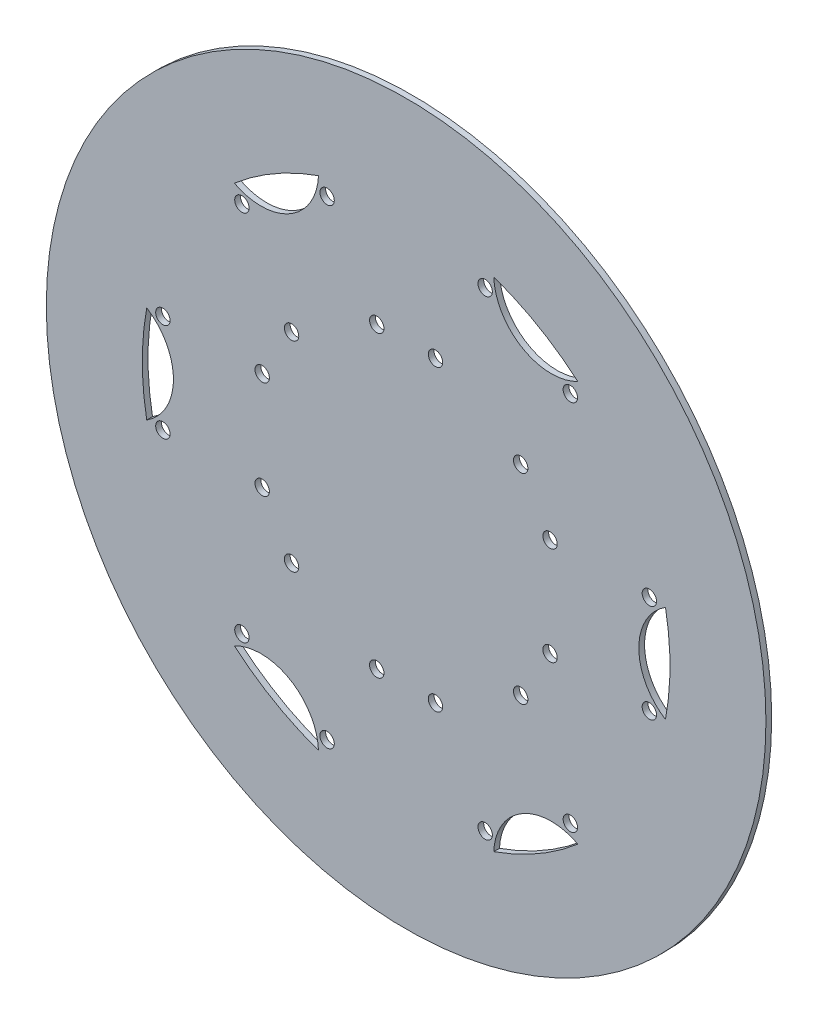
from build123d import *

# Parameters (mm, degrees)
SKETCH_1_R          = 75
EXTRUDE_1_DEPTH     = 1.2
SKETCH_2_R          = 1.5
CUT_EXTRUDE_1_DEPTH = 107.072805186


with BuildPart() as part:
    # 草图1 → 凸台-拉伸1 (new body)
    with BuildSketch(Plane.XY):
        Circle(SKETCH_1_R)
    extrude(amount=EXTRUDE_1_DEPTH)

    # 草图2 → 切除-拉伸1 (cut, through all)
    with BuildSketch(Plane.XY.offset(1.2)):
        with Locations((-16.473239611, 49.032487972)):
            Circle(SKETCH_2_R)
        with Locations((-6.123239611, 31.105762114)):
            Circle(SKETCH_2_R)
        with Locations((-23.876760389, 20.855762114)):
            Circle(SKETCH_2_R)
        with Locations((-34.226760389, 38.782487972)):
            Circle(SKETCH_2_R)
        with Locations((23.876760389, 20.855762114)):
            Circle(SKETCH_2_R)
        with Locations((6.123239611, 31.105762114)):
            Circle(SKETCH_2_R)
        with Locations((16.473239611, 49.032487972)):
            Circle(SKETCH_2_R)
        with Locations((34.226760389, 38.782487972)):
            Circle(SKETCH_2_R)
        with Locations((30, -10.25)):
            Circle(SKETCH_2_R)
        with Locations((30, 10.25)):
            Circle(SKETCH_2_R)
        with Locations((50.7, 10.25)):
            Circle(SKETCH_2_R)
        with Locations((50.7, -10.25)):
            Circle(SKETCH_2_R)
        with Locations((6.123239611, -31.105762114)):
            Circle(SKETCH_2_R)
        with Locations((23.876760389, -20.855762114)):
            Circle(SKETCH_2_R)
        with Locations((34.226760389, -38.782487972)):
            Circle(SKETCH_2_R)
        with Locations((16.473239611, -49.032487972)):
            Circle(SKETCH_2_R)
        with Locations((-23.876760389, -20.855762114)):
            Circle(SKETCH_2_R)
        with Locations((-6.123239611, -31.105762114)):
            Circle(SKETCH_2_R)
        with Locations((-16.473239611, -49.032487972)):
            Circle(SKETCH_2_R)
        with Locations((-34.226760389, -38.782487972)):
            Circle(SKETCH_2_R)
        with Locations((-30, 10.25)):
            Circle(SKETCH_2_R)
        with Locations((-30, -10.25)):
            Circle(SKETCH_2_R)
        with Locations((-50.7, -10.25)):
            Circle(SKETCH_2_R)
        with Locations((-50.7, 10.25)):
            Circle(SKETCH_2_R)
        with BuildLine():
            ThreePointArc((-18.261036187, 51.880001517), (-24.25, 42.002232084), (-35.798881168, 41.754521996))
            ThreePointArc((-35.798881168, 41.754521996), (-27.5, 47.631397208), (-18.261036187, 51.880001517))
        make_face()
        with BuildLine():
            ThreePointArc((35.798881168, 41.754521996), (24.25, 42.002232084), (18.261036187, 51.880001517))
            ThreePointArc((18.261036187, 51.880001517), (27.5, 47.631397208), (35.798881168, 41.754521996))
        make_face()
        with BuildLine():
            ThreePointArc((54.059917355, -10.125479521), (48.5, 0), (54.059917355, 10.125479521))
            ThreePointArc((54.059917355, 10.125479521), (55, 0), (54.059917355, -10.125479521))
        make_face()
        with BuildLine():
            ThreePointArc((18.261036187, -51.880001517), (24.25, -42.002232084), (35.798881168, -41.754521996))
            ThreePointArc((35.798881168, -41.754521996), (27.5, -47.631397208), (18.261036187, -51.880001517))
        make_face()
        with BuildLine():
            ThreePointArc((-35.798881168, -41.754521996), (-24.25, -42.002232084), (-18.261036187, -51.880001517))
            ThreePointArc((-18.261036187, -51.880001517), (-27.5, -47.631397208), (-35.798881168, -41.754521996))
        make_face()
        with BuildLine():
            ThreePointArc((-54.059917355, 10.125479521), (-48.5, 0), (-54.059917355, -10.125479521))
            ThreePointArc((-54.059917355, -10.125479521), (-55, 0), (-54.059917355, 10.125479521))
        make_face()
    extrude(amount=-CUT_EXTRUDE_1_DEPTH, mode=Mode.SUBTRACT)


solid = part.part
